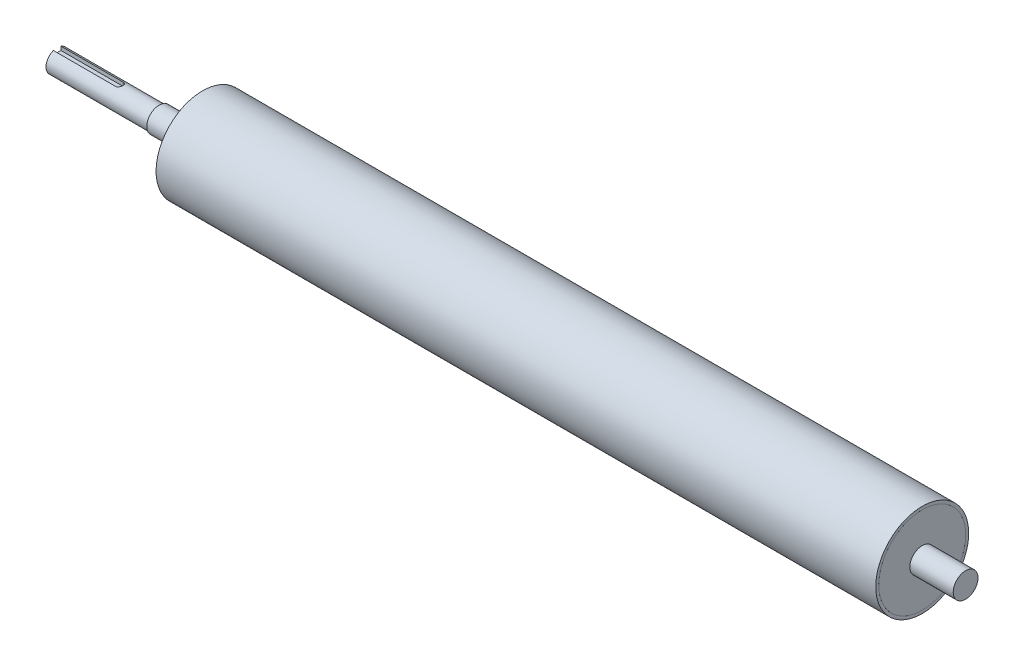
from build123d import *

# Parameters (mm, degrees)
SKETCH1_W           = 580.6
SKETCH1_H           = 2.3995
SKETCH2_R           = 35.1
SKETCH2_R_2         = 10.0005
BOSS_EXTRUDE1_DEPTH = 10
SKETCH3_R           = 35.1
SKETCH3_R_2         = 10.0005
BOSS_EXTRUDE2_DEPTH = 10
CUT_EXTRUDE1_DEPTH  = 3.5


with BuildPart() as part:
    # Sketch1 → Revolve1 (revolve)
    with BuildSketch(Plane.XY, mode=Mode.PRIVATE) as revolve1_sk:
        with Locations((0, 36.30025)):
            Rectangle(SKETCH1_W, SKETCH1_H)
    revolve(revolve1_sk.sketch.rotate(Axis((-290.3, 0, 0), (1, 0, 0)), 180), axis=Axis((-290.3, 0, 0), (1, 0, 0)))


with BuildPart() as body_2:
    # Sketch2 → Boss-Extrude1 (new body)
    with BuildSketch(Plane.ZY.offset(290.3)):
        with Locations(Location((0, 0, 0), (0, 0, 270))):
            Circle(SKETCH2_R)
        with Locations(Location((0, 0, 0), (0, 0, 270))):
            Circle(SKETCH2_R_2, mode=Mode.SUBTRACT)
    extrude(amount=-BOSS_EXTRUDE1_DEPTH)


with BuildPart() as body_3:
    # Sketch3 → Boss-Extrude2 (new body)
    with BuildSketch(Plane(origin=(290.3, 0, 0), x_dir=(0, 0, -1), z_dir=(1, 0, 0))):
        with Locations(Location((0, 0, 0), (0, 0, 90))):
            Circle(SKETCH3_R)
        with Locations(Location((0, 0, 0), (0, 0, 90))):
            Circle(SKETCH3_R_2, mode=Mode.SUBTRACT)
    extrude(amount=-BOSS_EXTRUDE2_DEPTH)


with BuildPart() as body_4:
    # Sketch4 → Revolve3 (revolve)
    with BuildSketch(Plane.XY, mode=Mode.PRIVATE) as revolve3_sk:
        Polygon((-325.3, 10), (325.3, 10), (325.3, 0), (-407.6, 0), (-407.6, 9), (-325.3, 9), align=None)
    revolve(revolve3_sk.sketch.rotate(Axis((-407.6, 0, 0), (1, 0, 0)), 180), axis=Axis((-407.6, 0, 0), (1, 0, 0)))

    # Sketch5 → Cut-Extrude1 (cut)
    with BuildSketch(Plane(origin=(0, 9, 0), x_dir=(1, 0, 0), z_dir=(0, 1, 0))):
        with BuildLine():
            Line((-407.6, 3), (-357.6, 3))
            ThreePointArc((-357.6, 3), (-354.6, 0), (-357.6, -3))
            Line((-357.6, -3), (-407.6, -3))
            Line((-407.6, -3), (-407.6, 3))
        make_face()
    extrude(amount=-CUT_EXTRUDE1_DEPTH, mode=Mode.SUBTRACT)


solid = Compound([part.part, body_2.part, body_3.part, body_4.part])
